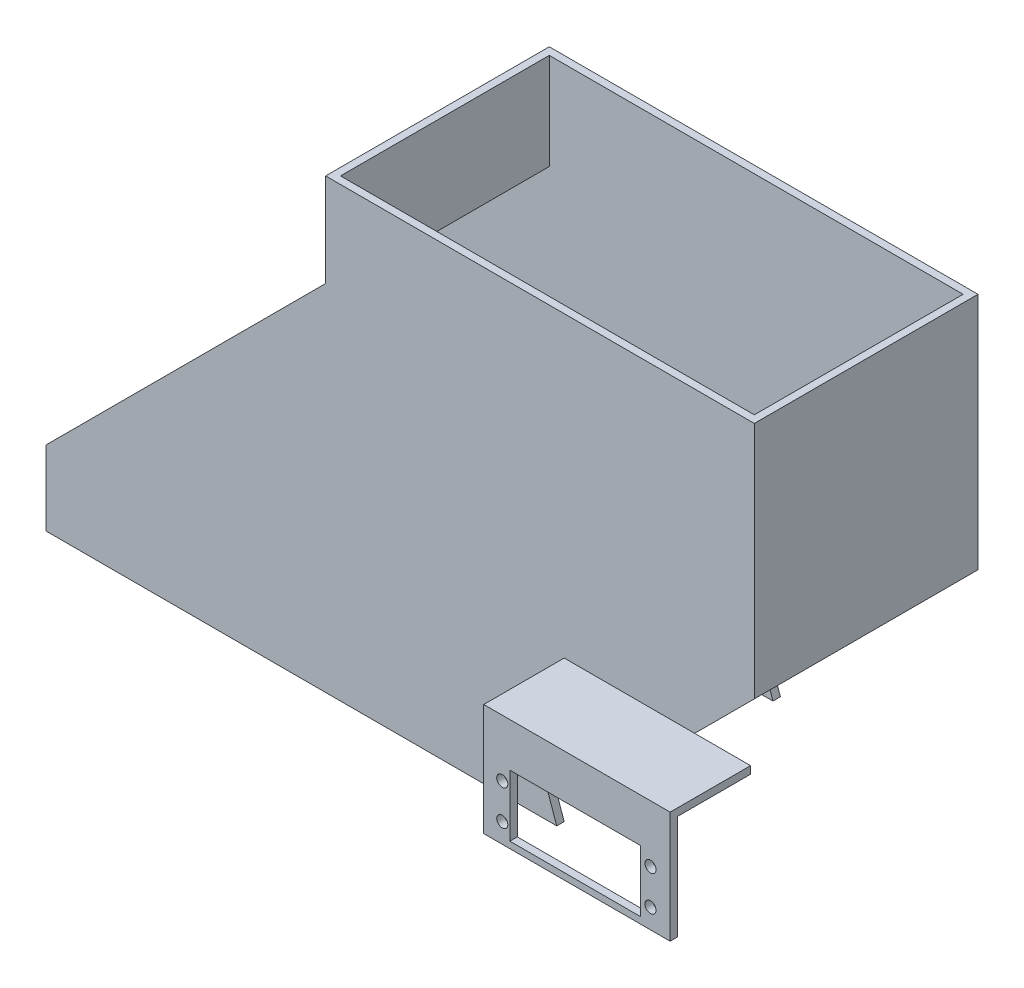
from build123d import *

# Parameters (mm, degrees)
BOSS_EXTRUDE3_DEPTH = 30
SHELL1_T            = -2
BOSS_EXTRUDE2_DEPTH = 25
CUT_EXTRUDE1_REACH  = 172.593
SKETCH5_W           = 35
SKETCH5_H           = 16.5
CUT_EXTRUDE2_REACH  = 173.535
SKETCH6_R           = 1.486127865


with BuildPart() as part:
    # Sketch8 → Boss-Extrude3 (new, symmetric)
    with BuildSketch(Plane.XY):
        Polygon((77, 0), (113, 36), (113, 100), (-2, 100), (-2, 75), (-77, 0), (-77, -20), (60, -20), (54, -3), (54, 0), align=None)
    extrude(amount=BOSS_EXTRUDE3_DEPTH, both=True)

    # Shell1
    shell1_openings = [part.faces().sort_by_distance(p)[0] for p in [
        (54, -1.5, 0),
        (57, -11.5, 0),
        (-8.5, -20, 0),
        (-77, -10, 0),
        (55.5, 100, 0),
        (65.5, 0, 0),
    ]]
    offset(amount=SHELL1_T, openings=shell1_openings, kind=Kind.INTERSECTION)

    # Sketch4 → Boss-Extrude2 (add, symmetric)
    with BuildSketch(Plane(origin=(87, 0, 0), x_dir=(0, 0, -1), z_dir=(1, 0, 0))):
        Polygon((-30, 20), (-30, 18), (-49.58, 18), (-49.58, -10), (-51.58, -10), (-51.58, 20), align=None)
    extrude(amount=BOSS_EXTRUDE2_DEPTH, both=True)

    # Sketch5 → Cut-Extrude1 (cut, up to next)
    with BuildSketch(Plane(origin=(0, 0, 49.58), x_dir=(-1, 0, 0), z_dir=(0, 0, -1)), mode=Mode.PRIVATE) as cut_extrude1_sk1:
        with Locations((-86.503731014, 0)):
            Rectangle(SKETCH5_W, SKETCH5_H)
    cut_extrude1_tool1 = extrude(cut_extrude1_sk1.sketch, amount=-CUT_EXTRUDE1_REACH, mode=Mode.PRIVATE) & part.part
    add(cut_extrude1_tool1.solids().sort_by_distance((86.503731, 0, 49.58))[0], mode=Mode.SUBTRACT)

    # Sketch6 → Cut-Extrude2 (cut, up to next)
    with BuildSketch(Plane.XY.offset(51.58), mode=Mode.PRIVATE) as cut_extrude2_sk1:
        with Locations((66.968636912, 4.723763571)):
            Circle(SKETCH6_R)
    cut_extrude2_tool1 = extrude(cut_extrude2_sk1.sketch, amount=-CUT_EXTRUDE2_REACH, mode=Mode.PRIVATE) & part.part
    # Sketch6 → Cut-Extrude2 (cut, up to next)
    with BuildSketch(Plane.XY.offset(51.58), mode=Mode.PRIVATE) as cut_extrude2_sk2:
        with Locations((106.722557298, 4.723763571)):
            Circle(SKETCH6_R)
    cut_extrude2_tool2 = extrude(cut_extrude2_sk2.sketch, amount=-CUT_EXTRUDE2_REACH, mode=Mode.PRIVATE) & part.part
    # Sketch6 → Cut-Extrude2 (cut, up to next)
    with BuildSketch(Plane.XY.offset(51.58), mode=Mode.PRIVATE) as cut_extrude2_sk3:
        with Locations((106.722557298, -4.723763571)):
            Circle(SKETCH6_R)
    cut_extrude2_tool3 = extrude(cut_extrude2_sk3.sketch, amount=-CUT_EXTRUDE2_REACH, mode=Mode.PRIVATE) & part.part
    # Sketch6 → Cut-Extrude2 (cut, up to next)
    with BuildSketch(Plane.XY.offset(51.58), mode=Mode.PRIVATE) as cut_extrude2_sk4:
        with Locations((66.968636912, -4.723763571)):
            Circle(SKETCH6_R)
    cut_extrude2_tool4 = extrude(cut_extrude2_sk4.sketch, amount=-CUT_EXTRUDE2_REACH, mode=Mode.PRIVATE) & part.part
    add(cut_extrude2_tool1.solids().sort_by_distance((66.968637, 4.723764, 51.58))[0], mode=Mode.SUBTRACT)
    add(cut_extrude2_tool2.solids().sort_by_distance((106.722557, 4.723764, 51.58))[0], mode=Mode.SUBTRACT)
    add(cut_extrude2_tool3.solids().sort_by_distance((106.722557, -4.723764, 51.58))[0], mode=Mode.SUBTRACT)
    add(cut_extrude2_tool4.solids().sort_by_distance((66.968637, -4.723764, 51.58))[0], mode=Mode.SUBTRACT)


solid = part.part
